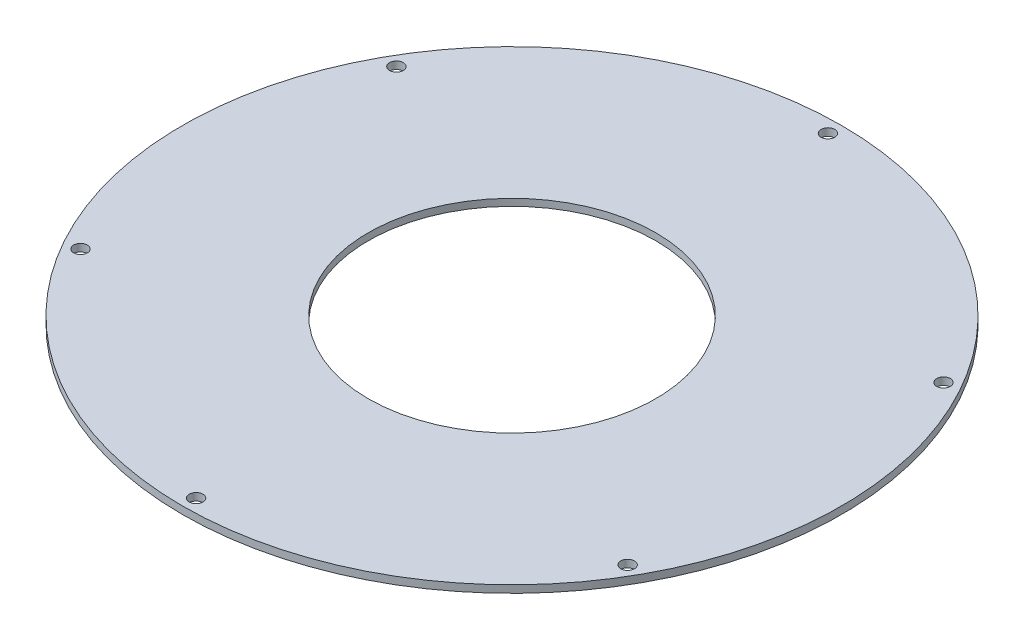
from build123d import *

# Parameters (mm, degrees)
SKETCH1_R           = 70.8759
SKETCH1_R_2         = 1.4732
SKETCH1_R_3         = 30.925
BOSS_EXTRUDE1_DEPTH = 1.6
SKETCH1_3_R         = 65
SKETCH1_3_R_2       = 30.925
CUT_EXTRUDE1_DEPTH  = 0.1


with BuildPart() as part:
    # Sketch1 → Boss-Extrude1 (new body)
    with BuildSketch(Plane(origin=(0, 0, 0), x_dir=(1, 0, 0), z_dir=(0, 1, 0))):
        Circle(SKETCH1_R)
        with Locations((-58.835990581, -33.968975)):
            Circle(SKETCH1_R_2, mode=Mode.SUBTRACT)
        with Locations((0, -67.93795)):
            Circle(SKETCH1_R_2, mode=Mode.SUBTRACT)
        with Locations((58.835990581, -33.968975)):
            Circle(SKETCH1_R_2, mode=Mode.SUBTRACT)
        with Locations((-58.835990581, 33.968975)):
            Circle(SKETCH1_R_2, mode=Mode.SUBTRACT)
        with Locations((0, 67.93795)):
            Circle(SKETCH1_R_2, mode=Mode.SUBTRACT)
        with Locations((58.835990581, 33.968975)):
            Circle(SKETCH1_R_2, mode=Mode.SUBTRACT)
        Circle(SKETCH1_R_3, mode=Mode.SUBTRACT)
    extrude(amount=BOSS_EXTRUDE1_DEPTH)

    # Sketch1<3> → Cut-Extrude1 (cut)
    with BuildSketch(Plane(origin=(0, 0, 0), x_dir=(1, 0, 0), z_dir=(0, 1, 0))):
        Circle(SKETCH1_3_R)
        Circle(SKETCH1_3_R_2, mode=Mode.SUBTRACT)
    extrude(amount=CUT_EXTRUDE1_DEPTH, mode=Mode.SUBTRACT)


solid = part.part
